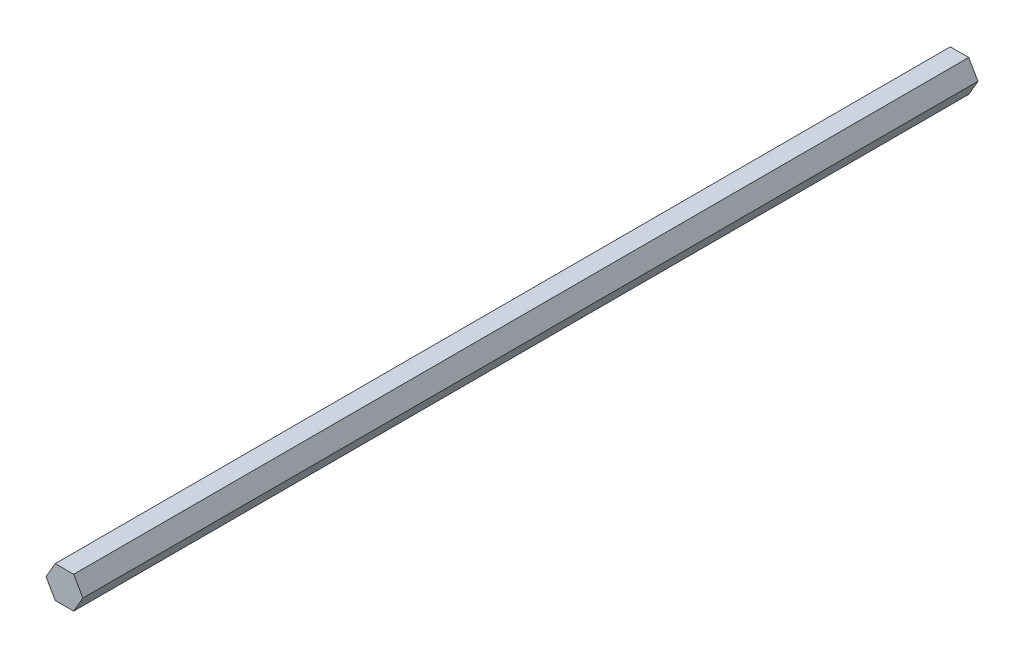
from build123d import *

# Parameters (mm, degrees)
BOSS_EXTRUDE1_DEPTH = 355.6


with BuildPart() as part:
    # Sketch1 → Boss-Extrude1 (new body)
    with BuildSketch(Plane.XY):
        Polygon((3.666174209, 6.35), (-3.666174209, 6.35), (-7.332348419, 0), (-3.666174209, -6.35), (3.666174209, -6.35), (7.332348419, 0), align=None)
    extrude(amount=BOSS_EXTRUDE1_DEPTH)


solid = part.part
